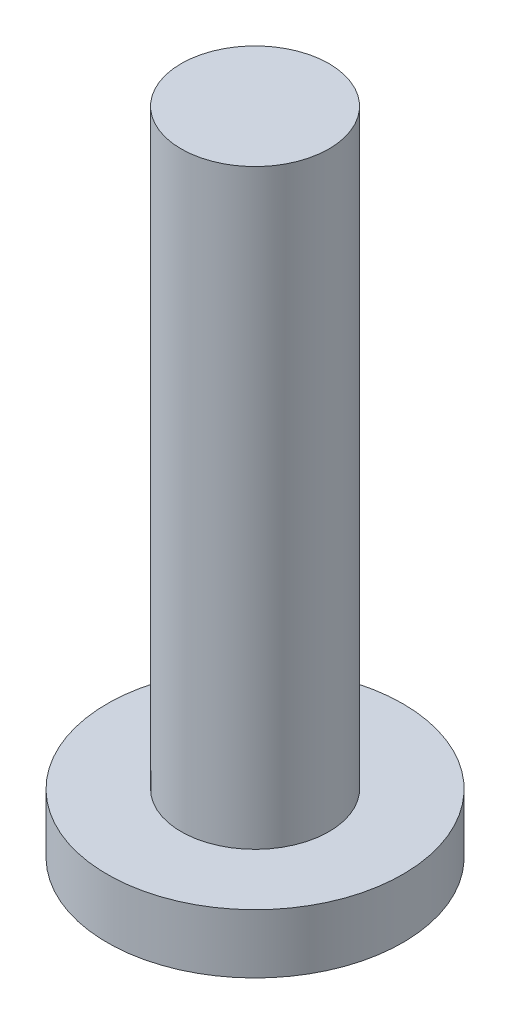
from build123d import *

# Parameters (mm, degrees)
SKETCH1_R           = 1.25
BOSS_EXTRUDE1_DEPTH = 10
SKETCH2_R           = 2.5
BOSS_EXTRUDE2_DEPTH = 1


with BuildPart() as part:
    # Sketch1 → Boss-Extrude1 (new body)
    with BuildSketch(Plane(origin=(0, 0, 0), x_dir=(1, 0, 0), z_dir=(0, 1, 0))):
        with Locations(Location((0, 0, 0), (0, 0, 270))):
            Circle(SKETCH1_R)
    extrude(amount=BOSS_EXTRUDE1_DEPTH)

    # Sketch2 → Boss-Extrude2 (add)
    with BuildSketch(Plane.XZ):
        with Locations(Location((0, 0, 0), (0, 0, 270))):
            Circle(SKETCH2_R)
    extrude(amount=BOSS_EXTRUDE2_DEPTH)


solid = part.part
